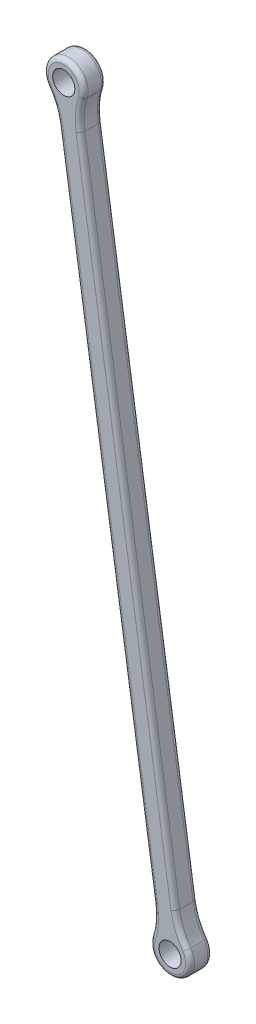
from build123d import *
from build123d.topology import SkipClean

# Parameters (mm, degrees)
BOSS_EXTRUDE2_DEPTH = 2.5
FILLET4_R           = 15
FILLET3_R           = 1


with BuildPart() as part:
    # Sketch3 → Boss-Extrude2 (new, symmetric)
    with SkipClean():  # the faces are left unmerged after this step: merging them gives an invalid solid
        with BuildSketch(Plane.XY):
            with BuildLine():
                ThreePointArc((30.698969170125505, 65.59418036163315), (31.158147399926214, 67.45168422123758), (32.79628901519803, 68.44044975637873))
                Line((32.79628901519794, 68.44044975637871), (9.57885297533118, 221.6917161907371))
                ThreePointArc((9.578852975331099, 221.69171619073705), (7.7213491157267296, 222.15089442053778), (6.732583580585612, 223.78903603580954))
                Line((6.732583580585612, 223.78903603580954), (7.293046103556714, 220.08959259654122))
                Line((7.293046103556714, 220.08959259654122), (30.138506647154426, 69.29362380090143))
                Line((30.138506647154426, 69.29362380090143), (30.698969170125523, 65.59418036163316))
            make_face()
            with BuildLine():
                Line((9.57885297533118, 221.6917161907371), (32.79628901519794, 68.44044975637871))
                ThreePointArc((32.79628901519803, 68.44044975637873), (34.65379287480238, 67.981271526578), (35.642558409943504, 66.34312991130628))
                Line((35.64255840994353, 66.34312991130628), (35.08209588697243, 70.04257335057454))
                Line((35.08209588697243, 70.04257335057454), (12.236635343374711, 220.8385421462144))
                Line((12.236635343374711, 220.8385421462144), (11.676172820403618, 224.53798558548266))
                ThreePointArc((11.67617282040362, 224.53798558548266), (11.697316883031004, 224.35127855311998), (11.704378200494617, 224.16351081064607))
                ThreePointArc((11.704378200494617, 224.16351081064607), (11.099923891989707, 222.5335088071337), (9.578852975331099, 221.69171619073705))
            make_face()
            with BuildLine():
                Line((35.08209588697243, 70.04257335057454), (35.64255840994353, 66.34312991130628))
                ThreePointArc((35.64255840994353, 66.34312991130628), (35.66370247257092, 66.1564228789436), (35.67076379003453, 65.9686551364697))
                ThreePointArc((35.67076379003453, 65.9686551364697), (33.35853153250842, 63.47571645393335), (30.698969170125526, 65.59418036163315))
                Line((30.698969170125523, 65.59418036163316), (30.138506647154426, 69.29362380090143))
                ThreePointArc((30.138506647154404, 69.29362380090143), (33.84481838474032, 61.51942482063349), (35.082095886972446, 70.04257335057454))
            make_face()
            with BuildLine():
                Line((7.293046103556714, 220.08959259654122), (6.732583580585612, 223.78903603580954))
                ThreePointArc((6.732583580585617, 223.78903603580954), (8.82990342565806, 226.6353054305551), (11.676172820403616, 224.53798558548266))
                Line((11.676172820403618, 224.53798558548266), (12.236635343374711, 220.8385421462144))
                ThreePointArc((12.23663534337469, 220.8385421462144), (8.530323605788727, 228.61274112648235), (7.293046103556694, 220.08959259654122))
            make_face()
        extrude(amount=BOSS_EXTRUDE2_DEPTH, both=True)

    # Fillet4
    fillet4_edges = [part.edges().sort_by_distance(p)[0] for p in [
        (35.08209588697243, 70.04257335057454, -1.25),
        (30.138506647154415, 69.29362380090143, 0),
        (7.293046103556704, 220.08959259654122, 0),
        (12.236635343374711, 220.8385421462144, -1.25),
    ]]
    fillet(fillet4_edges, radius=FILLET4_R)

    # Fillet3
    fillet3_edges = [part.edges().sort_by_distance(p)[0] for p in [
        (33.84481838474031, 61.51942482063349, -2.5),
        (33.84481838474031, 61.51942482063349, 2.5),
        (18.71577637535555, 144.69160819872144, -2.5),
        (18.715776375355546, 144.69160819872144, 2.5),
        (23.659365615173567, 145.4405577483945, -2.5),
        (23.659365615173567, 145.4405577483945, 2.5),
        (8.530323605788741, 228.61274112648235, -2.5),
        (8.530323605788741, 228.61274112648235, 2.5),
        (29.53395807325908, 70.68257566844231, -2.5),
        (29.53395807325908, 70.68257566844231, 2.5),
        (35.24810850264601, 71.54826458053549, -2.5),
        (35.24810850264601, 71.54826458053549, 2.5),
        (12.841183917270046, 219.44959027867358, -2.5),
        (12.841183917270046, 219.44959027867358, 2.5),
        (7.127033487882997, 218.58390136658036, -2.5),
        (7.127033487882997, 218.58390136658036, 2.5),
    ]]
    fillet(fillet3_edges, radius=FILLET3_R)


solid = part.part
